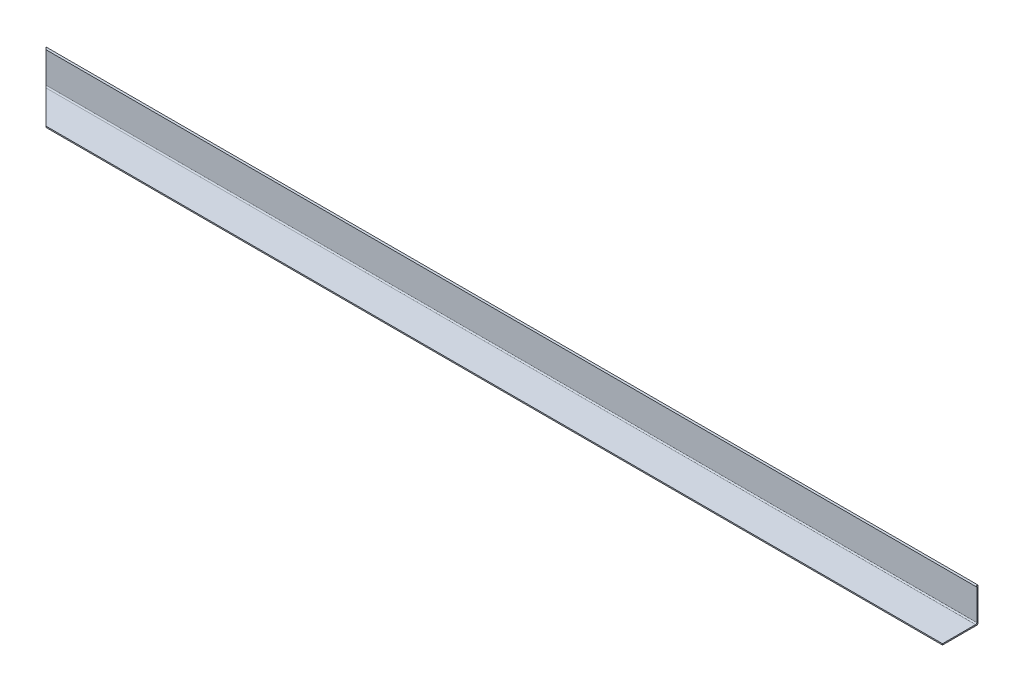
from build123d import *

# Parameters (mm, degrees)
BOSS_EXTRUDE1_DEPTH = 2310
FILLET1_R           = 3
CUT_EXTRUDE1_DEPTH  = 85
SKETCH3_W           = 2310
SKETCH3_H           = 30
CUT_EXTRUDE2_DEPTH  = 41


with BuildPart() as part:
    # Sketch1 → Boss-Extrude1 (new body)
    with BuildSketch(Plane(origin=(0, 0, 0), x_dir=(0, 0, -1), z_dir=(1, 0, 0))):
        Polygon((0, 0), (85, 0), (85, 82), (47, 82), (47, 112), (50, 112), (50, 85), (88, 85), (88, -3), (0, -3), align=None)
    extrude(amount=BOSS_EXTRUDE1_DEPTH)

    # Fillet1
    fillet1_edges = [part.edges().sort_by_distance(p)[0] for p in [
        (1155, 0, -85),
        (1155, 82, -85),
        (1155, 82, -47),
        (1155, 85, -50),
        (1155, 85, -88),
        (1155, -3, -88),
    ]]
    fillet(fillet1_edges, radius=FILLET1_R)

    # Sketch2 → Cut-Extrude1 (cut)
    with BuildSketch(Plane.XZ.offset(3)):
        Polygon((0, -88), (88, 0), (0, 0), align=None)
    extrude(amount=-CUT_EXTRUDE1_DEPTH, mode=Mode.SUBTRACT)

    # Sketch3 → Cut-Extrude2 (cut)
    with BuildSketch(Plane.XY.offset(-47)):
        with Locations((1155, 97)):
            Rectangle(SKETCH3_W, SKETCH3_H)
    extrude(amount=-CUT_EXTRUDE2_DEPTH, mode=Mode.SUBTRACT)


solid = part.part
